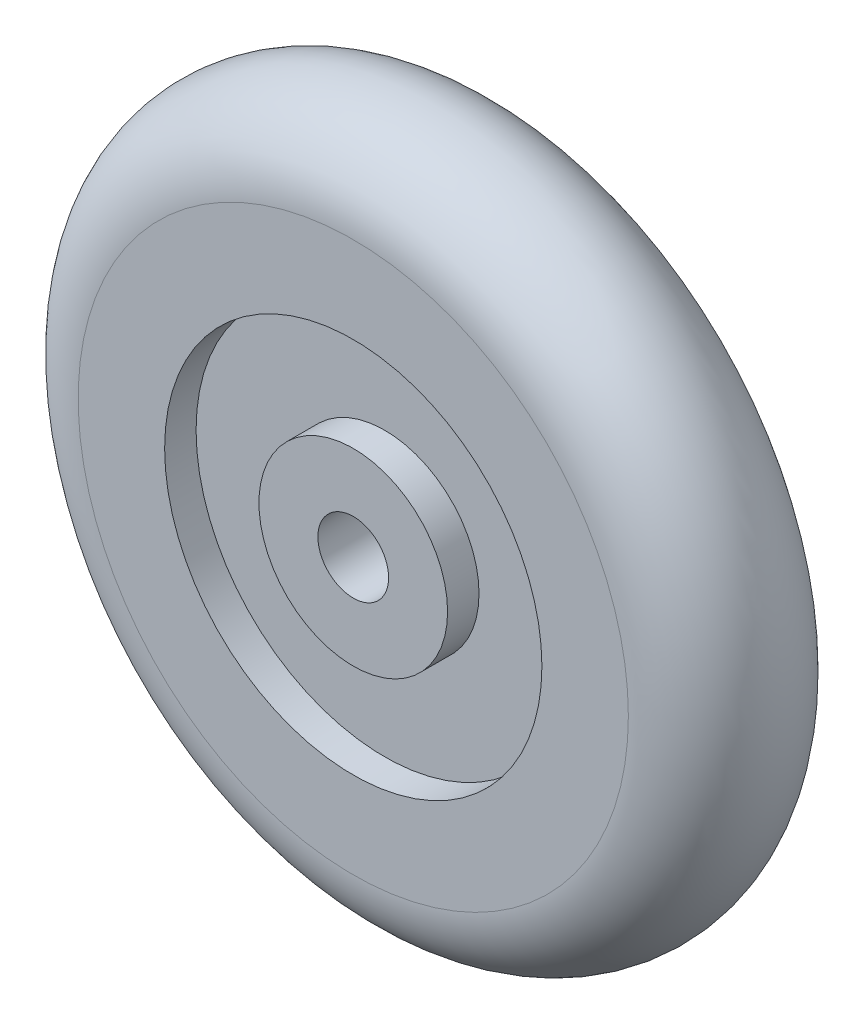
from build123d import *

# Parameters (mm, degrees)
SKETCH3_R          = 2.25
CUT_EXTRUDE2_DEPTH = 34.35416016


with BuildPart() as part:
    # Sketch1 → Revolve1 (revolve)
    with BuildSketch(Plane(origin=(0, 0, 0), x_dir=(0, 0, -1), z_dir=(1, 0, 0)), mode=Mode.PRIVATE) as revolve1_sk:
        with BuildLine():
            Line((0, 0), (0, -22.5))
            ThreePointArc((0, -22.5), (-3.535533906, -21.035533906), (-5, -17.5))
            Line((-5, -17.5), (-5, -12))
            Line((-5, -12), (-3, -12))
            Line((-3, -12), (-3, -6))
            Line((-3, -6), (-5, -6))
            Line((-5, -6), (-5, 0))
            Line((-5, 0), (0, 0))
        make_face()
    revolve1 = revolve(revolve1_sk.sketch.rotate(Axis((0, 0, 5), (0, 0, -1)), 270), axis=Axis((0, 0, 5), (0, 0, -1)))

    # Mirror1: Revolve1 across plane
    add(revolve1.mirror(Plane.XY))

    # Sketch3 → Cut-Extrude2 (cut, through all)
    with BuildSketch(Plane(origin=(0, 0, -5), x_dir=(-1, 0, 0), z_dir=(0, 0, -1))):
        Circle(SKETCH3_R)
    extrude(amount=-CUT_EXTRUDE2_DEPTH, mode=Mode.SUBTRACT)


solid = part.part
